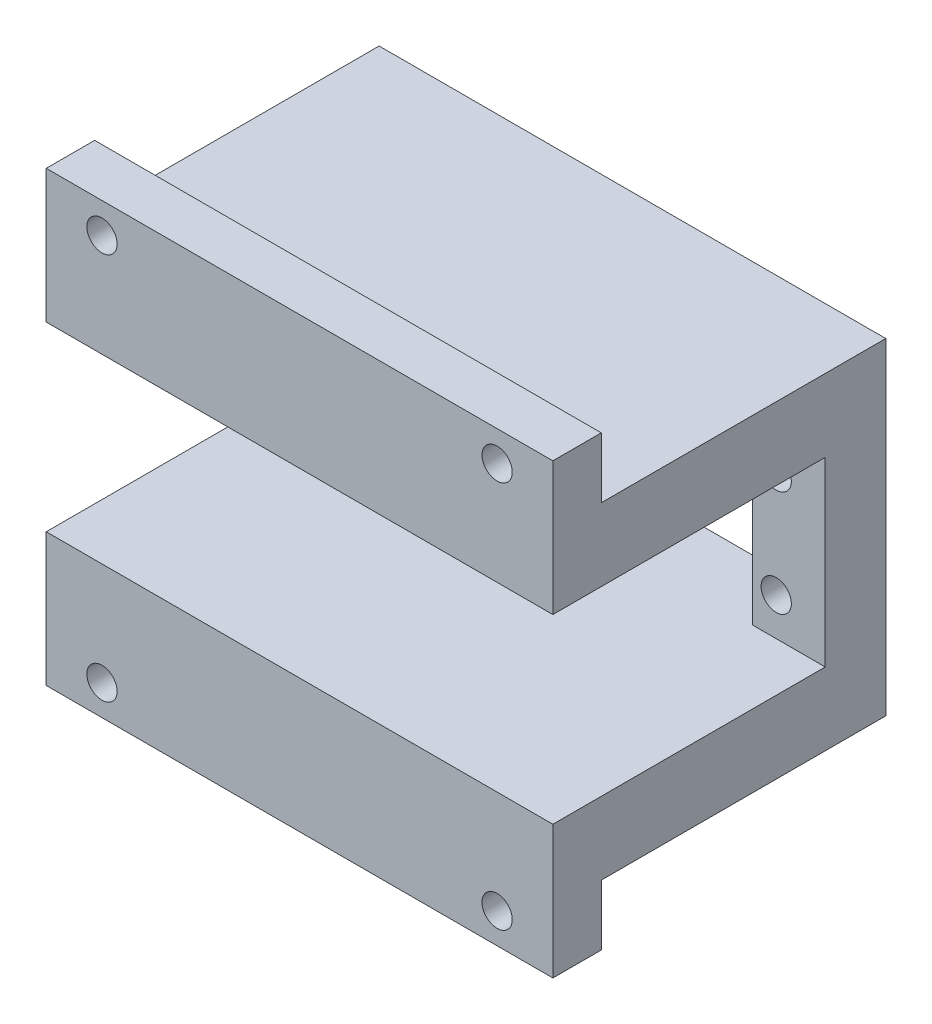
from build123d import *

# Parameters (mm, degrees)
CROQUIS1_R              = 2.5
SALIENTE_EXTRUIR1_DEPTH = 10
CROQUIS2_W              = 83.7
CROQUIS2_H              = 12
SALIENTE_EXTRUIR2_DEPTH = 45
CROQUIS3_W              = 83.7
CROQUIS3_H              = 8
SALIENTE_EXTRUIR3_DEPTH = 10
CORTAR_EXTRUIR1_REACH   = 87.411
CROQUIS4_R              = 2.5


with BuildPart() as part:
    # Croquis1 → Saliente-Extruir1 (new body)
    with BuildSketch(Plane.XY):
        Polygon((-33.081084665, 4.522845957), (-33.081084665, -3.763368441), (50.618915335, -3.763368441), (50.618915335, 4.522845957), (50.618915335, 50.236631559), (-33.081084665, 50.236631559), (-33.081084665, 7.26530538), align=None)
        with Locations((-24.981084665, 14.486631559)):
            Circle(CROQUIS1_R, mode=Mode.SUBTRACT)
        with Locations(Location((-24.981084665, 31.986631559, 0), (0, 0, 180))):
            Circle(CROQUIS1_R, mode=Mode.SUBTRACT)
        with Locations((42.518915335, 31.986631559)):
            Circle(CROQUIS1_R, mode=Mode.SUBTRACT)
        with Locations(Location((42.518915335, 14.486631559, 0), (0, 0, 180))):
            Circle(CROQUIS1_R, mode=Mode.SUBTRACT)
        with BuildLine():
            Line((38.618915335, 38.236631559), (-21.081084665, 38.236631559))
            Line((-21.081084665, 38.236631559), (-21.081084665, 26.736631559))
            Line((-21.081084665, 26.736631559), (-24.681084665, 26.736631559))
            ThreePointArc((-24.681084665, 26.736631559), (-28.281084665, 23.236631559), (-24.681084665, 19.736631559))
            Line((-24.681084665, 19.736631559), (-21.081084665, 19.736631559))
            Line((-21.081084665, 19.736631559), (-21.081084665, 8.236631559))
            Line((-21.081084665, 8.236631559), (15.848469228, 8.236631559))
            Line((15.848469228, 8.236631559), (38.618915335, 8.236631559))
            Line((38.618915335, 8.236631559), (38.618915335, 38.236631559))
        make_face(mode=Mode.SUBTRACT)
    extrude(amount=SALIENTE_EXTRUIR1_DEPTH)

    # Croquis2 → Saliente-Extruir2 (add)
    with BuildSketch(Plane.XY.offset(10)):
        with Locations((8.768915335, 2.236631559)):
            Rectangle(CROQUIS2_W, CROQUIS2_H)
        with Locations((8.768915335, 44.236631559)):
            Rectangle(CROQUIS2_W, CROQUIS2_H)
    extrude(amount=SALIENTE_EXTRUIR2_DEPTH)

    # Croquis3 → Saliente-Extruir3 (add)
    with BuildSketch(Plane.XZ.offset(3.763368441)):
        with Locations((8.768915335, 51)):
            Rectangle(CROQUIS3_W, CROQUIS3_H)
    saliente_extruir3 = extrude(amount=SALIENTE_EXTRUIR3_DEPTH)

    # Croquis4 → Cortar-Extruir1 (cut, up to next)
    with BuildSketch(Plane(origin=(0, 0, 47), x_dir=(-1, 0, 0), z_dir=(0, 0, -1)), mode=Mode.PRIVATE) as cortar_extruir1_sk1:
        with Locations((-41.410138607, -8.763368441)):
            Circle(CROQUIS4_R)
    cortar_extruir1_tool1 = extrude(cortar_extruir1_sk1.sketch, amount=-CORTAR_EXTRUIR1_REACH, mode=Mode.PRIVATE) & part.part
    # Croquis4 → Cortar-Extruir1 (cut, up to next)
    with BuildSketch(Plane(origin=(0, 0, 47), x_dir=(-1, 0, 0), z_dir=(0, 0, -1)), mode=Mode.PRIVATE) as cortar_extruir1_sk2:
        with Locations(Location((23.872307937, -8.763368441, 0), (0, 0, 180))):
            Circle(CROQUIS4_R)
    cortar_extruir1_tool2 = extrude(cortar_extruir1_sk2.sketch, amount=-CORTAR_EXTRUIR1_REACH, mode=Mode.PRIVATE) & part.part
    cortar_extruir1_1 = cortar_extruir1_tool1.solids().sort_by_distance((41.410139, -8.763368, 47))[0]
    add(cortar_extruir1_1, mode=Mode.SUBTRACT)
    cortar_extruir1_2 = cortar_extruir1_tool2.solids().sort_by_distance((-23.872308, -8.763368, 47))[0]
    add(cortar_extruir1_2, mode=Mode.SUBTRACT)
    cortar_extruir1 = cortar_extruir1_1 + cortar_extruir1_2  # Cortar-Extruir1 as one shape, for the pattern or mirror that repeats it

    # Simetría1: Saliente-Extruir3, Cortar-Extruir1 across plane
    add(saliente_extruir3.mirror(Plane.ZX.offset(23.236631559)))
    add(cortar_extruir1.mirror(Plane.ZX.offset(23.236631559)), mode=Mode.SUBTRACT)


solid = part.part
